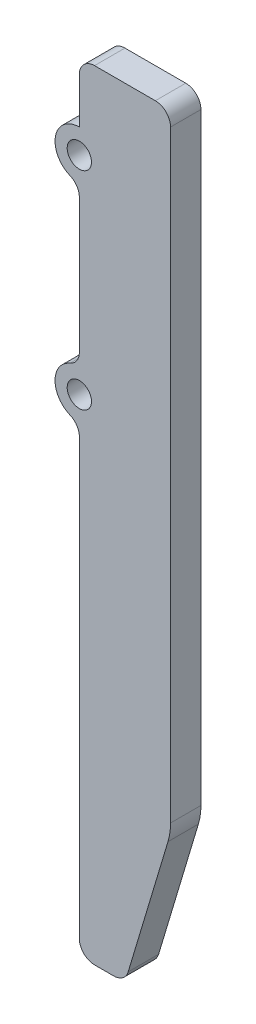
from build123d import *

# Parameters (mm, degrees)
SKETCH_1_R      = 2
EXTRUDE_1_DEPTH = 5
FILLET_1_R      = 2.5
FILLET_2_R      = 2.5
FILLET_3_R      = 10


with BuildPart() as part:
    # 草圖1 → 填料-伸長1 (new body)
    with BuildSketch(Plane.XY):
        with BuildLine():
            Line((-17.000169764, -31.546546547), (-9.500169764, -6.546546547))
            Line((-9.500169764, -6.546546547), (-9.500169764, 96.553453453))
            Line((-9.500169764, 96.553453453), (-24.500169764, 96.553453453))
            Line((-24.500169764, 96.553453453), (-24.500169764, 86.553453453))
            ThreePointArc((-24.500169764, 86.553453453), (-28.500169764, 82.553453453), (-24.500169764, 78.553453453))
            Line((-24.500169764, 78.553453453), (-24.500169764, 52.453453453))
            ThreePointArc((-24.500169764, 52.453453453), (-28.500169764, 48.453453453), (-24.500169764, 44.453453453))
            Line((-24.500169764, 44.453453453), (-24.500169764, -31.546546547))
            Line((-24.500169764, -31.546546547), (-17.000169764, -31.546546547))
        make_face()
        with Locations((-24.500169764, 82.553453453)):
            Circle(SKETCH_1_R, mode=Mode.SUBTRACT)
        with Locations((-24.500169764, 48.453453453)):
            Circle(SKETCH_1_R, mode=Mode.SUBTRACT)
    extrude(amount=EXTRUDE_1_DEPTH)

    # 圓角1
    fillet_1_edges = [part.edges().sort_by_distance(p)[0] for p in [
        (-24.500169764, 96.553453453, 2.5),
        (-9.500169764, 96.553453453, 2.5),
        (-17.000169764, -31.546546547, 2.5),
        (-24.500169764, -31.546546547, 2.5),
    ]]
    fillet(fillet_1_edges, radius=FILLET_1_R)

    # 圓角2
    fillet_2_edges = [part.edges().sort_by_distance(p)[0] for p in [
        (-24.500169764, 44.453453453, 2.5),
        (-24.500169764, 52.453453453, 2.5),
        (-24.500169764, 78.553453453, 2.5),
    ]]
    fillet(fillet_2_edges, radius=FILLET_2_R)

    # 圓角3
    fillet_3_edges = [part.edges().sort_by_distance(p)[0] for p in [
        (-9.500169764, -6.546546547, 2.5),
    ]]
    fillet(fillet_3_edges, radius=FILLET_3_R)


solid = part.part
